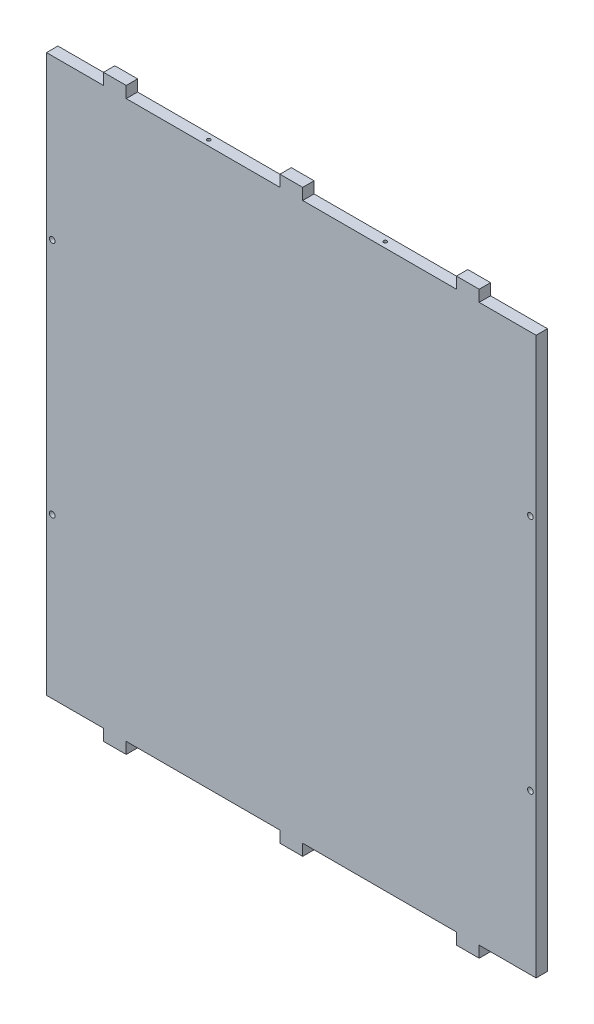
from build123d import *
from build123d.topology import SkipClean

# Parameters (mm, degrees)
SKIZZE1_W                       = 5
SKIZZE1_H                       = 5
SKIZZE1_W_2                     = 15
AUFSATZ_LINEAR_AUSTRAGEN1_DEPTH = 5
SKIZZE2_R                       = 2.75
SCHNITT_LINEAR_AUSTRAGEN1_DEPTH = 128.539996178
SCHNITT_LINEAR_AUSTRAGEN2_DEPTH = 128.539996178
SKIZZE4_R                       = 7.5
SCHNITT_LINEAR_AUSTRAGEN3_DEPTH = 128.539996178
SKIZZE5_R                       = 0.75
SKIZZE5_R_2                     = 6
SENSORS_DEPTH                   = 128.539996178
AUFSATZ_LINEAR_AUSTRAGEN2_DEPTH = 5
SKIZZE7_R                       = 1.25
SCHNITT_LINEAR_AUSTRAGEN5_DEPTH = 239.81729549
SKETCH1_W                       = 69.5
SKETCH1_H                       = 110
BOSS_EXTRUDE1_DEPTH             = 5
SKIZZE9_R                       = 0.75
SKIZZE9_R_2                     = 6
DISCRETECHANNEL_DEPTH           = 239.81729549
SKIZZE10_R                      = 0.75
SKIZZE10_R_2                    = 6
CONTCHANNEL_DEPTH               = 239.81729549
BOSS_EXTRUDE2_DEPTH             = 5
SKIZZE8_R                       = 0.75
SKIZZE8_R_2                     = 7.5
STEPDOWNCONVERTER_DEPTH         = 239.81729549
SKETCH3_R                       = 0.75
SKETCH3_R_2                     = 5
BBB_DEPTH                       = 5
BOSS_EXTRUDE3_DEPTH             = 5
SKETCH5_W                       = 55
SKETCH5_H                       = 244.45
CUT_EXTRUDE2_DEPTH              = 5
SKETCH6_R                       = 5
CUT_EXTRUDE3_DEPTH              = 5
SKETCH7_W                       = 5
SKETCH7_H                       = 10
BOSS_EXTRUDE4_DEPTH             = 5
SKETCH8_W                       = 10
SKETCH8_H                       = 5
BOSS_EXTRUDE5_DEPTH             = 5
BOSS_EXTRUDE6_START             = -5
SKETCH9_W                       = 210
SKETCH9_H                       = 244.45
SKETCH9_R                       = 2.75
SKETCH9_R_2                     = 7.5
BOSS_EXTRUDE6_DEPTH             = 5
SKETCH10_R                      = 1.25
CUT_EXTRUDE4_DEPTH              = 5
SKETCH11_R                      = 1.25
CUT_EXTRUDE5_DEPTH              = 211.370983325
SKETCH12_R                      = 0.75
CUT_EXTRUDE6_DEPTH              = 10
SKETCH13_W                      = 66.883325803
SKETCH13_H                      = 19.006877893
SKETCH13_W_2                    = 28.314677108
SKETCH13_H_2                    = 100.605818773
SKETCH13_W_3                    = 44.298538928
SKETCH13_H_3                    = 29.20603568
BOSS_EXTRUDE7_DEPTH             = 5
SKETCH14_W                      = 5
SKETCH14_H                      = 244.45
BOSS_EXTRUDE8_DEPTH             = 5
SKETCH15_R                      = 1.25
CUT_EXTRUDE7_DEPTH              = 5
SKETCH16_R                      = 1.25
BOSS_EXTRUDE9_DEPTH             = 5


with BuildPart() as part:
    # Skizze1 → Aufsatz-Linear austragen1 (new body)
    with BuildSketch(Plane.XY):
        Polygon((55, 67.225), (75, 67.225), (75, 72.225), (85, 72.225), (85, 67.225), (100, 67.225), (100, 47.225), (105, 47.225), (105, 37.225), (100, 37.225), (100, -37.225), (105, -37.225), (105, -47.225), (100, -47.225), (100, -67.225), (-100, -67.225), (-100, -47.225), (-105, -47.225), (-105, -37.225), (-100, -37.225), (-100, 37.225), (-105, 37.225), (-105, 47.225), (-100, 47.225), (-100, 67.225), (-85, 67.225), (-85, 72.225), (-75, 72.225), (-75, 67.225), (45, 67.225), (45, 72.225), (55, 72.225), align=None)
        with Locations((13, -40.055)):
            Rectangle(SKIZZE1_W, SKIZZE1_H, mode=Mode.SUBTRACT)
        with Locations((53, -40.055)):
            Rectangle(SKIZZE1_W, SKIZZE1_H, mode=Mode.SUBTRACT)
        with Locations((33, -40.055)):
            Rectangle(SKIZZE1_W_2, SKIZZE1_H, mode=Mode.SUBTRACT)
    extrude(amount=AUFSATZ_LINEAR_AUSTRAGEN1_DEPTH)

    # Skizze2 → Schnitt-Linear austragen1 (cut, through all)
    with BuildSketch(Plane.XY.offset(5)):
        with Locations((-59.5, 4.075)):
            Circle(SKIZZE2_R)
        with Locations((-24.5, -11.925)):
            Circle(SKIZZE2_R)
    extrude(amount=-SCHNITT_LINEAR_AUSTRAGEN1_DEPTH, mode=Mode.SUBTRACT)

    # Skizze3 → Schnitt-Linear austragen2 (cut, through all)
    with BuildSketch(Plane.XY.offset(5)):
        with BuildLine():
            Line((25, -17.555), (41, -17.555))
            ThreePointArc((41, -17.555), (42.414213562, -18.140786438), (43, -19.555))
            Line((43, -19.555), (43, -35.555))
            ThreePointArc((43, -35.555), (42.414213562, -36.969213562), (41, -37.555))
            Line((41, -37.555), (37, -37.555))
            Line((37, -37.555), (29, -37.555))
            Line((29, -37.555), (25, -37.555))
            ThreePointArc((25, -37.555), (23.585786438, -36.969213562), (23, -35.555))
            Line((23, -35.555), (23, -19.555))
            ThreePointArc((23, -19.555), (23.585786438, -18.140786438), (25, -17.555))
        make_face()
        with BuildLine():
            Line((-66.5, 54.225), (-66.5, 35.225))
            ThreePointArc((-66.5, 35.225), (-67.378679656, 33.103679656), (-69.5, 32.225))
            Line((-69.5, 32.225), (-88.5, 32.225))
            ThreePointArc((-88.5, 32.225), (-90.621320344, 33.103679656), (-91.5, 35.225))
            Line((-91.5, 35.225), (-91.5, 54.225))
            ThreePointArc((-91.5, 54.225), (-90.621320344, 56.346320344), (-88.5, 57.225))
            Line((-88.5, 57.225), (-69.5, 57.225))
            ThreePointArc((-69.5, 57.225), (-67.378679656, 56.346320344), (-66.5, 54.225))
        make_face()
        with BuildLine():
            Line((4.5, 57.225), (-14.5, 57.225))
            ThreePointArc((-14.5, 57.225), (-16.621320344, 56.346320344), (-17.5, 54.225))
            Line((-17.5, 54.225), (-17.5, 35.225))
            ThreePointArc((-17.5, 35.225), (-16.621320344, 33.103679656), (-14.5, 32.225))
            Line((-14.5, 32.225), (4.5, 32.225))
            ThreePointArc((4.5, 32.225), (6.621320344, 33.103679656), (7.5, 35.225))
            Line((7.5, 35.225), (7.5, 54.225))
            ThreePointArc((7.5, 54.225), (6.621320344, 56.346320344), (4.5, 57.225))
        make_face()
    extrude(amount=-SCHNITT_LINEAR_AUSTRAGEN2_DEPTH, mode=Mode.SUBTRACT)

    # Skizze4 → Schnitt-Linear austragen3 (cut, through all)
    with BuildSketch(Plane.XY.offset(5)):
        with Locations((-80.5, -30.925)):
            Circle(SKIZZE4_R)
        with Locations((-80.5, -11.925)):
            Circle(SKIZZE4_R)
        with Locations(Location((-80.5, -49.925, 0), (0, 0, 180))):
            Circle(SKIZZE4_R)
    extrude(amount=-SCHNITT_LINEAR_AUSTRAGEN3_DEPTH, mode=Mode.SUBTRACT)

    # Skizze5 → Sensors (cut, through all)
    with BuildSketch(Plane.XY.offset(5)):
        with Locations((-8, -45.225)):
            Circle(SKIZZE5_R)
        with Locations((-8, -3.225)):
            Circle(SKIZZE5_R)
        with Locations((83, -12.225)):
            Circle(SKIZZE5_R)
        with Locations((-15, -56.225)):
            Circle(SKIZZE5_R_2)
        with Locations((0, -56.225)):
            Circle(SKIZZE5_R_2)
        with Locations((15, -56.225)):
            Circle(SKIZZE5_R_2)
        with Locations((30, -56.225)):
            Circle(SKIZZE5_R_2)
        with Locations((45, -56.225)):
            Circle(SKIZZE5_R_2)
        with Locations((60, -56.225)):
            Circle(SKIZZE5_R_2)
        with Locations((75, -56.225)):
            Circle(SKIZZE5_R_2)
        with Locations((90, -56.225)):
            Circle(SKIZZE5_R_2)
    extrude(amount=-SENSORS_DEPTH, mode=Mode.SUBTRACT)

    # Skizze6 → Aufsatz-Linear austragen2 (add)
    with BuildSketch(Plane(origin=(0, 0, 0), x_dir=(-1, 0, 0), z_dir=(0, 0, -1))):
        Polygon((160, 47.225), (160, 37.225), (160, -37.225), (160, -47.225), (160, -67.225), (100, -67.225), (100, 67.225), (-30.5, 67.225), (-30.5, 177.225), (160, 177.225), (160, 67.225), align=None)
    extrude(amount=-AUFSATZ_LINEAR_AUSTRAGEN2_DEPTH)

    # Skizze7 → Schnitt-Linear austragen5 (cut, through all)
    with BuildSketch(Plane(origin=(0, 0, 0), x_dir=(-1, 0, 0), z_dir=(0, 0, -1))):
        with Locations((71.5, 32.775)):
            Circle(SKIZZE7_R)
        with Locations((96.5, 32.775)):
            Circle(SKIZZE7_R)
        with Locations((46.5, 32.775)):
            Circle(SKIZZE7_R)
    extrude(amount=-SCHNITT_LINEAR_AUSTRAGEN5_DEPTH, mode=Mode.SUBTRACT)

    # Sketch1 → Boss-Extrude1 (add)
    with BuildSketch(Plane.XY.offset(5)):
        with Locations((65.25, 122.225)):
            Rectangle(SKETCH1_W, SKETCH1_H)
    extrude(amount=-BOSS_EXTRUDE1_DEPTH)

    # Skizze9 → DiscreteChannel (cut, through all)
    with BuildSketch(Plane.XY.offset(5)):
        with Locations((8, 71.515)):
            Circle(SKIZZE9_R)
        with Locations(Location((69, 71.515, 0), (0, 0, 180))):
            Circle(SKIZZE9_R)
        with Locations(Location((8, 10.515, 0), (0, 0, 180))):
            Circle(SKIZZE9_R)
        with Locations((69, 10.515)):
            Circle(SKIZZE9_R)
        with Locations((-2, 5.015)):
            Circle(SKIZZE9_R_2)
        with Locations((-2, 29.015)):
            Circle(SKIZZE9_R_2)
        with Locations((-2, 53.015)):
            Circle(SKIZZE9_R_2)
        with Locations((-2, 77.015)):
            Circle(SKIZZE9_R_2)
    extrude(amount=-DISCRETECHANNEL_DEPTH, mode=Mode.SUBTRACT)

    # Skizze10 → ContChannel (cut, through all)
    with BuildSketch(Plane.XY.offset(5)):
        with Locations((-4, 136.225)):
            Circle(SKIZZE10_R)
        with Locations(Location((-4, 94.225, 0), (0, 0, 180))):
            Circle(SKIZZE10_R)
        with Locations(Location((-96, 136.225, 0), (0, 0, 180))):
            Circle(SKIZZE10_R)
        with Locations((-96, 94.225)):
            Circle(SKIZZE10_R)
        with Locations((-72.499999267, 166.225)):
            Circle(SKIZZE10_R_2)
        with Locations((-57.499999267, 166.225)):
            Circle(SKIZZE10_R_2)
        with Locations((-42.499999267, 166.225)):
            Circle(SKIZZE10_R_2)
        with Locations((-27.499999267, 166.225)):
            Circle(SKIZZE10_R_2)
        with Locations((-27.499999267, 151.225)):
            Circle(SKIZZE10_R_2)
        with Locations((-42.499999267, 151.225)):
            Circle(SKIZZE10_R_2)
        with Locations((-57.499999267, 151.225)):
            Circle(SKIZZE10_R_2)
        with Locations((-72.499999267, 151.225)):
            Circle(SKIZZE10_R_2)
    extrude(amount=-CONTCHANNEL_DEPTH, mode=Mode.SUBTRACT)

    # Sketch2 → Boss-Extrude2 (add)
    with SkipClean():  # the faces are left unmerged after this step: merging them gives an invalid solid
        with BuildSketch(Plane.XY.offset(5)):
            with BuildLine():
                Line((-14.5, 32.225), (-7.069112348, 32.225))
                ThreePointArc((-7.069112348, 32.225), (-2, 35.015), (3.069112348, 32.225))
                Line((3.069112348, 32.225), (4.5, 32.225))
                ThreePointArc((4.5, 32.225), (6.621320344, 33.103679656), (7.5, 35.225))
                Line((7.5, 35.225), (7.5, 54.225))
                ThreePointArc((7.5, 54.225), (6.621320344, 56.346320344), (4.5, 57.225))
                Line((4.5, 57.225), (2.275032164, 57.225))
                ThreePointArc((2.275032164, 57.225), (-2, 47.015), (-6.275032164, 57.225))
                Line((-6.275032164, 57.225), (-14.5, 57.225))
                ThreePointArc((-14.5, 57.225), (-16.621320344, 56.346320344), (-17.5, 54.225))
                Line((-17.5, 54.225), (-17.5, 35.225))
                ThreePointArc((-17.5, 35.225), (-16.621320344, 33.103679656), (-14.5, 32.225))
            make_face()
        extrude(amount=-BOSS_EXTRUDE2_DEPTH)

    # Skizze8 → StepDownConverter (cut, through all)
    with SkipClean():  # the faces are left unmerged after this step: merging them gives an invalid solid
        with BuildSketch(Plane.XY.offset(5)):
            with Locations((62.5, 153.225)):
                Circle(SKIZZE8_R)
            with Locations(Location((93.5, 153.225, 0), (0, 0, 180))):
                Circle(SKIZZE8_R)
            with Locations(Location((62.5, 100.225, 0), (0, 0, 180))):
                Circle(SKIZZE8_R)
            with Locations((93.5, 100.225)):
                Circle(SKIZZE8_R)
            with Locations((78, 86.225)):
                Circle(SKIZZE8_R_2)
            with Locations(Location((78, 167.225, 0), (0, 0, 180))):
                Circle(SKIZZE8_R_2)
        extrude(amount=-STEPDOWNCONVERTER_DEPTH, mode=Mode.SUBTRACT)

    # Sketch3 → BBB (cut)
    with SkipClean():  # the faces are left unmerged after this step: merging them gives an invalid solid
        with BuildSketch(Plane.XY.offset(5)):
            with Locations((21.85, 147.68)):
                Circle(SKETCH3_R)
            with Locations((87.89, 102.59)):
                Circle(SKETCH3_R)
            with Locations(Location((87.89, 150.86, 0), (0, 0, 180))):
                Circle(SKETCH3_R)
            with Locations(Location((21.85, 105.77, 0), (0, 0, 180))):
                Circle(SKETCH3_R)
            with Locations((13, 167.225)):
                Circle(SKETCH3_R_2)
            with Locations((28, 167.225)):
                Circle(SKETCH3_R_2)
            with Locations((43, 167.225)):
                Circle(SKETCH3_R_2)
            with Locations((58, 167.225)):
                Circle(SKETCH3_R_2)
            with Locations(Location((13, 86.225, 0), (0, 0, 180))):
                Circle(SKETCH3_R_2)
        extrude(amount=-BBB_DEPTH, mode=Mode.SUBTRACT)

    # Sketch4 → Boss-Extrude3 (add)
    with SkipClean():  # the faces are left unmerged after this step: merging them gives an invalid solid
        with BuildSketch(Plane.XY.offset(5)):
            with BuildLine():
                Line((-88.5, 32.225), (-72.622497216, 32.225))
                ThreePointArc((-72.622497216, 32.225), (-71.5, 34.025), (-70.377502784, 32.225))
                Line((-70.377502784, 32.225), (-69.5, 32.225))
                ThreePointArc((-69.5, 32.225), (-67.378679656, 33.103679656), (-66.5, 35.225))
                Line((-66.5, 35.225), (-66.5, 54.225))
                ThreePointArc((-66.5, 54.225), (-67.378679656, 56.346320344), (-69.5, 57.225))
                Line((-69.5, 57.225), (-88.5, 57.225))
                ThreePointArc((-88.5, 57.225), (-90.621320344, 56.346320344), (-91.5, 54.225))
                Line((-91.5, 54.225), (-91.5, 35.225))
                ThreePointArc((-91.5, 35.225), (-90.621320344, 33.103679656), (-88.5, 32.225))
            make_face()
        extrude(amount=-BOSS_EXTRUDE3_DEPTH)

    # Sketch5 → Cut-Extrude2 (cut)
    with SkipClean():  # the faces are left unmerged after this step: merging them gives an invalid solid
        with BuildSketch(Plane.XY.offset(5)):
            with Locations((-132.5, 55)):
                Rectangle(SKETCH5_W, SKETCH5_H)
        extrude(amount=-CUT_EXTRUDE2_DEPTH, mode=Mode.SUBTRACT)

    # Sketch6 → Cut-Extrude3 (cut)
    with SkipClean():  # the faces are left unmerged after this step: merging them gives an invalid solid
        with BuildSketch(Plane.XY.offset(5)):
            with Locations((-95, 82.775)):
                Circle(SKETCH6_R)
            with Locations((-80, 82.775)):
                Circle(SKETCH6_R)
            with Locations((-95, -32.225)):
                Circle(SKETCH6_R)
            with Locations((-65, 82.775)):
                Circle(SKETCH6_R)
        extrude(amount=-CUT_EXTRUDE3_DEPTH, mode=Mode.SUBTRACT)

    # Sketch7 → Boss-Extrude4 (add)
    with SkipClean():  # the faces are left unmerged after this step: merging them gives an invalid solid
        with BuildSketch(Plane.XY.offset(5)):
            with Locations((102.5, 152.225)):
                Rectangle(SKETCH7_W, SKETCH7_H)
        extrude(amount=-BOSS_EXTRUDE4_DEPTH)

    # Sketch8 → Boss-Extrude5 (add)
    with SkipClean():  # the faces are left unmerged after this step: merging them gives an invalid solid
        with BuildSketch(Plane.XY.offset(5)):
            with Locations((-80, -69.725)):
                Rectangle(SKETCH8_W, SKETCH8_H)
            with Locations((-2.5, -69.725)):
                Rectangle(SKETCH8_W, SKETCH8_H)
            with Locations((75, -69.725)):
                Rectangle(SKETCH8_W, SKETCH8_H)
            with Locations((75, 179.725)):
                Rectangle(SKETCH8_W, SKETCH8_H)
            with Locations((-2.5, 179.725)):
                Rectangle(SKETCH8_W, SKETCH8_H)
            with Locations((-80, 179.725)):
                Rectangle(SKETCH8_W, SKETCH8_H)
        extrude(amount=-BOSS_EXTRUDE5_DEPTH)

    # Sketch9 → Boss-Extrude6 (add)
    with BuildSketch(Plane(origin=(0, 0, 0), x_dir=(-1, 0, 0), z_dir=(0, 0, -1)).offset(BOSS_EXTRUDE6_START)):
        with Locations((0, 55)):
            Rectangle(SKETCH9_W, SKETCH9_H)
        with Locations(Location((59.5, 4.075, 0), (0, 0, 180))):
            Circle(SKETCH9_R, mode=Mode.SUBTRACT)
        with Locations(Location((24.5, -11.925, 0), (0, 0, 180))):
            Circle(SKETCH9_R, mode=Mode.SUBTRACT)
        with Locations((80.5, -49.925)):
            Circle(SKETCH9_R_2, mode=Mode.SUBTRACT)
        with Locations(Location((80.5, -30.925, 0), (0, 0, 180))):
            Circle(SKETCH9_R_2, mode=Mode.SUBTRACT)
        with Locations(Location((80.5, -11.925, 0), (0, 0, 180))):
            Circle(SKETCH9_R_2, mode=Mode.SUBTRACT)
    extrude(amount=BOSS_EXTRUDE6_DEPTH)

    # Sketch10 → Cut-Extrude4 (cut)
    with BuildSketch(Plane(origin=(0, 0, 0), x_dir=(-1, 0, 0), z_dir=(0, 0, -1))):
        with Locations((-45, 82.225)):
            Circle(SKETCH10_R)
        with Locations((-20, 82.225)):
            Circle(SKETCH10_R)
        with Locations((5, 82.225)):
            Circle(SKETCH10_R)
    extrude(amount=-CUT_EXTRUDE4_DEPTH, mode=Mode.SUBTRACT)

    # Sketch11 → Cut-Extrude5 (cut, through all)
    with BuildSketch(Plane(origin=(0, 0, 0), x_dir=(-1, 0, 0), z_dir=(0, 0, -1))):
        with Locations((-102.5, 107.225)):
            Circle(SKETCH11_R)
        with Locations(Location((-102.5, 2.775, 0), (0, 0, 180))):
            Circle(SKETCH11_R)
        with Locations((102.5, 2.775)):
            Circle(SKETCH11_R)
        with Locations(Location((102.5, 107.225, 0), (0, 0, 180))):
            Circle(SKETCH11_R)
    extrude(amount=-CUT_EXTRUDE5_DEPTH, mode=Mode.SUBTRACT)

    # Sketch12 → Cut-Extrude6 (cut)
    with BuildSketch(Plane(origin=(0, 177.225, 0), x_dir=(1, 0, 0), z_dir=(0, 1, 0))):
        with Locations(Location((-41.25, -2.5, 0), (0, 0, 270))):
            Circle(SKETCH12_R)
        with Locations(Location((36.25, -2.5, 0), (0, 0, 270))):
            Circle(SKETCH12_R)
    cut_extrude6 = extrude(amount=-CUT_EXTRUDE6_DEPTH, mode=Mode.SUBTRACT)

    # Mirror1: Cut-Extrude6 across plane
    add(cut_extrude6.mirror(Plane.ZX.offset(55)), mode=Mode.SUBTRACT)

    # Sketch13 → Boss-Extrude7 (add)
    with BuildSketch(Plane(origin=(0, 0, 0), x_dir=(-1, 0, 0), z_dir=(0, 0, -1))):
        with Locations((-18.62921432, 79.896589462)):
            Rectangle(SKETCH13_W, SKETCH13_H)
        with Locations((81.845523282, -14.081860775)):
            Rectangle(SKETCH13_W_2, SKETCH13_H_2)
        with Locations((40.616720798, -5.090395938)):
            Rectangle(SKETCH13_W_3, SKETCH13_H_3)
    extrude(amount=-BOSS_EXTRUDE7_DEPTH)

    # Sketch14 → Boss-Extrude8 (add)
    with BuildSketch(Plane.ZY.offset(105)):
        with Locations((2.5, 55)):
            Rectangle(SKETCH14_W, SKETCH14_H)
    extrude(amount=BOSS_EXTRUDE8_DEPTH)

    # Sketch15 → Cut-Extrude7 (cut)
    with BuildSketch(Plane(origin=(0, 0, 0), x_dir=(-1, 0, 0), z_dir=(0, 0, -1))):
        with Locations((102.5, 2.775)):
            Circle(SKETCH15_R)
        with Locations(Location((102.5, 107.225, 0), (0, 0, 180))):
            Circle(SKETCH15_R)
        with Locations((107.5, 2.775)):
            Circle(SKETCH15_R)
        with Locations((107.5, 107.225)):
            Circle(SKETCH15_R)
    extrude(amount=-CUT_EXTRUDE7_DEPTH, mode=Mode.SUBTRACT)

    # Sketch16 → Boss-Extrude9 (add)
    with BuildSketch(Plane(origin=(0, 0, 0), x_dir=(-1, 0, 0), z_dir=(0, 0, -1))):
        with Locations((102.5, 2.775)):
            Circle(SKETCH16_R)
        with Locations((102.5, 107.225)):
            Circle(SKETCH16_R)
    extrude(amount=-BOSS_EXTRUDE9_DEPTH)


solid = part.part
